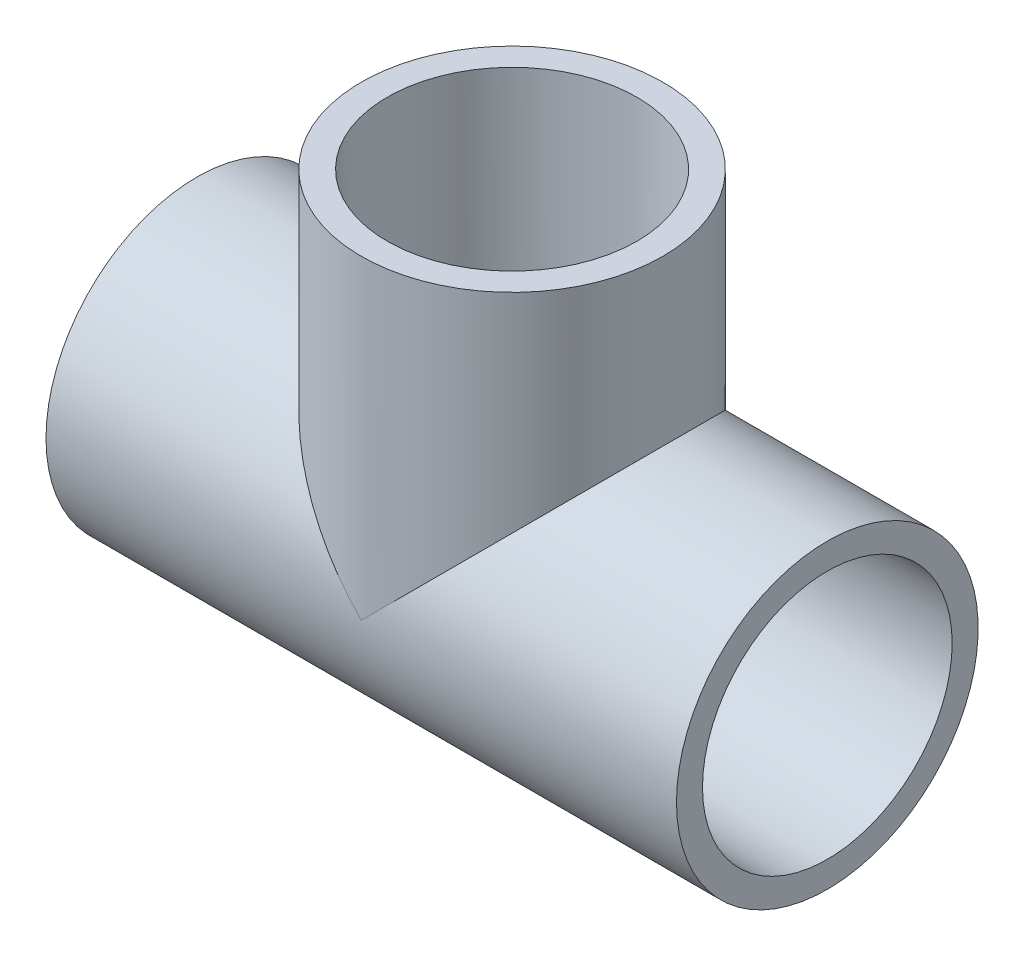
from build123d import *

# Parameters (mm, degrees)
BOSS_EXTRUDE1_START = 34.9504
SKETCH4_R           = 20.3327
BOSS_EXTRUDE1_DEPTH = 34.9504
SKETCH5_R           = 20.3327
BOSS_EXTRUDE2_DEPTH = 17.4752


with BuildPart() as part:
    # Sketch1 → Revolve1 (revolve)
    with BuildSketch(Plane.XY, mode=Mode.PRIVATE) as revolve1_sk:
        Polygon((-42.4942, -20.3327), (-17.4752, -20.3327), (-17.4752, -16.637), (-42.4942, -16.8275), align=None)
        Polygon((42.4942, -16.8275), (17.4752, -16.637), (17.4752, -20.3327), (42.4942, -20.3327), align=None)
    revolve(revolve1_sk.sketch.rotate(Axis((-42.4942, 0, 0), (1, 0, 0)), 270), axis=Axis((-42.4942, 0, 0), (1, 0, 0)))



with BuildPart() as body_2:
    # Sketch2 → Revolve2 (revolve)
    with BuildSketch(Plane.XY):
        Polygon((16.8275, 42.4942), (16.637, 17.4752), (20.3327, 17.4752), (20.3327, 42.4942), align=None)
    revolve(axis=Axis((0, 0, 0), (0, 1, 0)))


with BuildPart() as part_1:
    add(part.part)

    add(body_2.part)  # Boss-Extrude1 merges body 2
    # Sketch4 → Boss-Extrude1 (add)
    with BuildSketch(Plane(origin=(-17.4752, 0, 0), x_dir=(0, 0, -1), z_dir=(1, 0, 0)).offset(BOSS_EXTRUDE1_START)):
        with Locations(Location((0, 0, 0), (0, 0, 180))):
            Circle(SKETCH4_R)
    extrude(amount=-BOSS_EXTRUDE1_DEPTH)

    # Sketch5 → Boss-Extrude2 (add)
    with BuildSketch(Plane.XZ.offset(-17.4752)):
        Circle(SKETCH5_R)
    extrude(amount=BOSS_EXTRUDE2_DEPTH)

    # Sketch6 → Cut-Revolve1 (revolve, cut)
    with BuildSketch(Plane.XY, mode=Mode.PRIVATE) as cut_revolve1_sk:
        Polygon((-42.4942, -16.8275), (-17.4752, -16.637), (-17.4752, -13.3223), (17.4752, -13.3223), (17.4752, -16.637), (42.4942, -16.8275), (42.4942, 0), (-42.4942, 0), align=None)
    revolve(cut_revolve1_sk.sketch.rotate(Axis((42.4942, 0, 0), (-1, 0, 0)), 270), axis=Axis((42.4942, 0, 0), (-1, 0, 0)), mode=Mode.SUBTRACT)

    # Sketch7 → Cut-Revolve2 (revolve, cut)
    with BuildSketch(Plane.XY):
        Polygon((16.8275, 42.4942), (16.637, 17.4752), (13.3223, 17.4752), (13.3223, 0), (0, 0), (0, 42.4942), align=None)
    revolve(axis=Axis((0, 0, 0), (0, 1, 0)), mode=Mode.SUBTRACT)


solid = part_1.part
